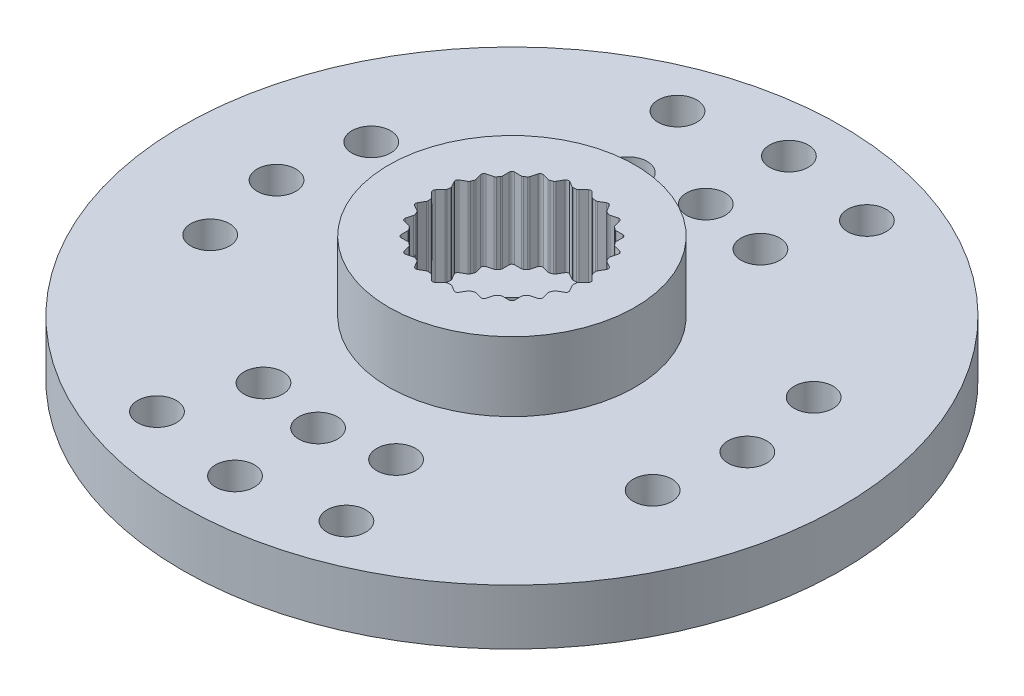
from build123d import *

# Parameters (mm, degrees)
SKETCH_1_R                       = 11.9
EXTRUDE_1_DEPTH                  = 2
SKETCH_2_R                       = 4.45
EXTRUDE_2_DEPTH                  = 2.5
SKETCH_3_R                       = 3.75
EXTRUDE_3_DEPTH                  = 0.5
SKETCH_4_R                       = 3
CUT_EXTRUDE_1_DEPTH              = 1
SKETCH_5_R                       = 1.4
CUT_EXTRUDE_2_DEPTH              = 18.29797676
SKETCH_6_R                       = 2.65
CUT_EXTRUDE_3_DEPTH              = 2.9
CUT_EXTRUDE_4_DEPTH              = 2.9
FILLET_1_R                       = 0.1
PATTERN_CIRCULAR_1_COUNT         = 24
FILLET_1_OF_PATTERN_CIRCULAR_1_R = 0.1
SKETCH_8_R                       = 0.7
CUT_EXTRUDE_5_DEPTH              = 18.420390352
PATTERN_CIRCULAR_2_COUNT         = 18
SKETCH_10_R                      = 0.7
CUT_EXTRUDE_6_DEPTH              = 18.420390352
PATTERN_CIRCULAR_3_COUNT         = 18


with BuildPart() as part:
    # Эскиз1 → Бобышка-Вытянуть1 (new body)
    with BuildSketch(Plane(origin=(0, 0, 0), x_dir=(1, 0, 0), z_dir=(0, 1, 0))):
        with Locations(Location((0, 0, 0), (0, 0, 270))):
            Circle(SKETCH_1_R)
    extrude(amount=EXTRUDE_1_DEPTH)

    # Эскиз2 → Бобышка-Вытянуть2 (add)
    with BuildSketch(Plane(origin=(0, 2, 0), x_dir=(1, 0, 0), z_dir=(0, 1, 0))):
        with Locations(Location((0, 0, 0), (0, 0, 270))):
            Circle(SKETCH_2_R)
    extrude(amount=EXTRUDE_2_DEPTH)

    # Эскиз3 → Бобышка-Вытянуть3 (add)
    with BuildSketch(Plane.XZ):
        with Locations(Location((0, 0, 0), (0, 0, 90))):
            Circle(SKETCH_3_R)
    extrude(amount=EXTRUDE_3_DEPTH)

    # Эскиз4 → Вырез-Вытянуть1 (cut)
    with BuildSketch(Plane.XZ.offset(0.5)):
        with Locations(Location((0, 0, 0), (0, 0, 270))):
            Circle(SKETCH_4_R)
    extrude(amount=-CUT_EXTRUDE_1_DEPTH, mode=Mode.SUBTRACT)

    # Эскиз5 → Вырез-Вытянуть2 (cut, through all)
    with BuildSketch(Plane.XZ.offset(-0.5)):
        with Locations(Location((0, 0, 0), (0, 0, 270))):
            Circle(SKETCH_5_R)
    extrude(amount=-CUT_EXTRUDE_2_DEPTH, mode=Mode.SUBTRACT)

    # Эскиз6 → Вырез-Вытянуть3 (cut)
    with BuildSketch(Plane(origin=(0, 4.5, 0), x_dir=(1, 0, 0), z_dir=(0, 1, 0))):
        with Locations(Location((0, 0, 0), (0, 0, 270))):
            Circle(SKETCH_6_R)
    extrude(amount=-CUT_EXTRUDE_3_DEPTH, mode=Mode.SUBTRACT)

    # Эскиз7 → Вырез-Вытянуть4 (cut)
    with BuildSketch(Plane(origin=(0, 4.5, 0), x_dir=(1, 0, 0), z_dir=(0, 1, 0))):
        with BuildLine():
            Line((0, 2.9), (-0.263092253, 2.636907747))
            ThreePointArc((-0.263092253, 2.636907747), (0, 2.65), (0.263092253, 2.636907747))
            Line((0.263092253, 2.636907747), (0, 2.9))
        make_face()
    cut_extrude_4 = extrude(amount=-CUT_EXTRUDE_4_DEPTH, mode=Mode.SUBTRACT)

    # Скругление1
    fillet_1_edges = [part.edges().sort_by_distance(p)[0] for p in [
        (0, 3.05, -2.9),
        (0.263092253, 3.05, -2.636907747),
        (-0.263092253, 3.05, -2.636907747),
    ]]
    fillet(fillet_1_edges, radius=FILLET_1_R)

    # Круговой массив1: Вырез-Вытянуть4 ×24 about axis
    pattern_circular_1_axis = Axis((0, 0, 0), (0, 1, 0))
    for i in range(1, PATTERN_CIRCULAR_1_COUNT):
        add(cut_extrude_4.rotate(pattern_circular_1_axis, i * 360 / PATTERN_CIRCULAR_1_COUNT), mode=Mode.SUBTRACT)

    # Скругление1 of Круговой массив1
    fillet_1_of_pattern_circular_1_edges = [part.edges().sort_by_distance(p)[0] for p in [
        (-0.750575231, 3.05, -2.801184896),
        (-0.428354343, 3.05, -2.61515058),
        (-0.936609547, 3.05, -2.478964009),
        (-1.45, 3.05, -2.511473671),
        (-1.090609299, 3.05, -2.415175223),
        (-1.546298448, 3.05, -2.15208297),
        (-2.050609665, 3.05, -2.050609665),
        (-1.678541033, 3.05, -2.050609665),
        (-2.050609665, 3.05, -1.678541033),
        (-2.511473671, 3.05, -1.45),
        (-2.15208297, 3.05, -1.546298448),
        (-2.415175223, 3.05, -1.090609299),
        (-2.801184896, 3.05, -0.750575231),
        (-2.478964009, 3.05, -0.936609547),
        (-2.61515058, 3.05, -0.428354343),
        (-2.9, 3.05, 0),
        (-2.636907747, 3.05, -0.263092253),
        (-2.636907747, 3.05, 0.263092253),
        (-2.801184896, 3.05, 0.750575231),
        (-2.61515058, 3.05, 0.428354343),
        (-2.478964009, 3.05, 0.936609547),
        (-2.511473671, 3.05, 1.45),
        (-2.415175223, 3.05, 1.090609299),
        (-2.15208297, 3.05, 1.546298448),
        (-2.050609665, 3.05, 2.050609665),
        (-2.050609665, 3.05, 1.678541033),
        (-1.678541033, 3.05, 2.050609665),
        (-1.45, 3.05, 2.511473671),
        (-1.546298448, 3.05, 2.15208297),
        (-1.090609299, 3.05, 2.415175223),
        (-0.750575231, 3.05, 2.801184896),
        (-0.936609547, 3.05, 2.478964009),
        (-0.428354343, 3.05, 2.61515058),
        (0, 3.05, 2.9),
        (-0.263092253, 3.05, 2.636907747),
        (0.263092253, 3.05, 2.636907747),
        (0.750575231, 3.05, 2.801184896),
        (0.428354343, 3.05, 2.61515058),
        (0.936609547, 3.05, 2.478964009),
        (1.45, 3.05, 2.511473671),
        (1.090609299, 3.05, 2.415175223),
        (1.546298448, 3.05, 2.15208297),
        (2.050609665, 3.05, 2.050609665),
        (1.678541033, 3.05, 2.050609665),
        (2.050609665, 3.05, 1.678541033),
        (2.511473671, 3.05, 1.45),
        (2.15208297, 3.05, 1.546298448),
        (2.415175223, 3.05, 1.090609299),
        (2.801184896, 3.05, 0.750575231),
        (2.478964009, 3.05, 0.936609547),
        (2.61515058, 3.05, 0.428354343),
        (2.9, 3.05, 0),
        (2.636907747, 3.05, 0.263092253),
        (2.636907747, 3.05, -0.263092253),
        (2.801184896, 3.05, -0.750575231),
        (2.61515058, 3.05, -0.428354343),
        (2.478964009, 3.05, -0.936609547),
        (2.511473671, 3.05, -1.45),
        (2.415175223, 3.05, -1.090609299),
        (2.15208297, 3.05, -1.546298448),
        (2.050609665, 3.05, -2.050609665),
        (2.050609665, 3.05, -1.678541033),
        (1.678541033, 3.05, -2.050609665),
        (1.45, 3.05, -2.511473671),
        (1.546298448, 3.05, -2.15208297),
        (1.090609299, 3.05, -2.415175223),
        (0.750575231, 3.05, -2.801184896),
        (0.936609547, 3.05, -2.478964009),
        (0.428354343, 3.05, -2.61515058),
    ]]
    fillet(fillet_1_of_pattern_circular_1_edges, radius=FILLET_1_OF_PATTERN_CIRCULAR_1_R)

    # Эскиз8 → Вырез-Вытянуть5 (cut, through all)
    with BuildSketch(Plane.XZ):
        with Locations(Location((0, 10, 0), (0, 0, 270))):
            Circle(SKETCH_8_R)
        with Locations(Location((0, 7, 0), (0, 0, 270))):
            Circle(SKETCH_8_R)
    cut_extrude_5 = extrude(amount=-CUT_EXTRUDE_5_DEPTH, mode=Mode.SUBTRACT)

    # Круговой массив2: Вырез-Вытянуть5 ×18 about axis, 12 skipped
    pattern_circular_2_axis = Axis((0, 0, 0), (0, -1, 0))
    add([cut_extrude_5.rotate(pattern_circular_2_axis, i * 360 / PATTERN_CIRCULAR_2_COUNT) for i in range(1, PATTERN_CIRCULAR_2_COUNT) if i not in (2, 3, 4, 5, 6, 7, 11, 12, 13, 14, 15, 16)], mode=Mode.SUBTRACT)

    # Эскиз10 → Вырез-Вытянуть6 (cut, through all)
    with BuildSketch(Plane.XZ):
        with Locations(Location((8.5, 0, 0), (0, 0, 270))):
            Circle(SKETCH_10_R)
    cut_extrude_6 = extrude(amount=-CUT_EXTRUDE_6_DEPTH, mode=Mode.SUBTRACT)

    # Круговой массив3: Вырез-Вытянуть6 ×18 about axis, 12 skipped
    pattern_circular_3_axis = Axis((0, 0, 0), (0, -1, 0))
    add([cut_extrude_6.rotate(pattern_circular_3_axis, i * 360 / PATTERN_CIRCULAR_3_COUNT) for i in range(1, PATTERN_CIRCULAR_3_COUNT) if i not in (2, 3, 4, 5, 6, 7, 11, 12, 13, 14, 15, 16)], mode=Mode.SUBTRACT)


solid = part.part
